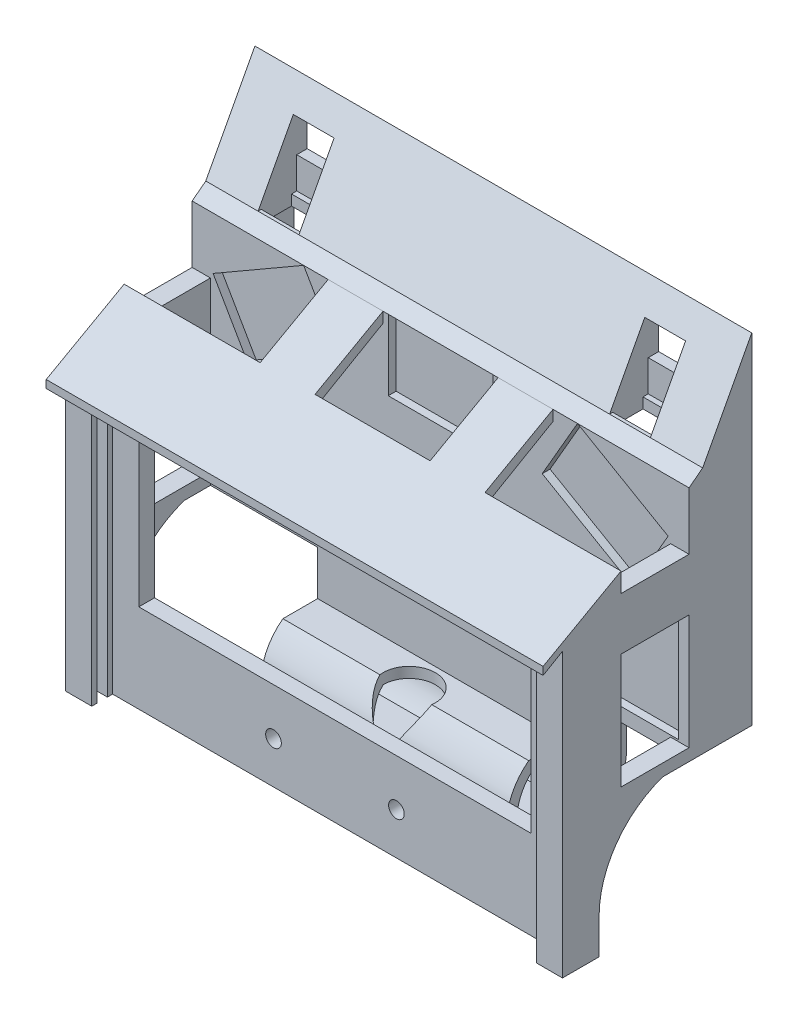
from build123d import *

# Parameters (mm, degrees)
SALIENTE_EXTRUIR1_DEPTH    = 12
CORTAR_EXTRUIR1_DEPTH      = 107.888961076
SALIENTE_EXTRUIR2_DEPTH    = 95
CORTAR_EXTRUIR2_DEPTH      = 44
CORTAR_EXTRUIR2_DEPTH_BACK = 44
CROQUIS6_W                 = 75
CROQUIS6_H                 = 35
CORTAR_EXTRUIR3_DEPTH      = 5
CROQUIS8_W                 = 13
CROQUIS8_H                 = 22
CORTAR_EXTRUIR10_DEPTH     = 114.460389564
CROQUIS9_W                 = 22
CROQUIS9_H                 = 13
CORTAR_EXTRUIR11_DEPTH     = 114.460389564
CROQUIS10_W                = 13
CROQUIS10_H                = 13
CORTAR_EXTRUIR12_DEPTH     = 26
CROQUIS11_W                = 13
CROQUIS11_H                = 13
CORTAR_EXTRUIR13_DEPTH     = 26
CROQUIS12_W                = 80
CROQUIS12_H                = 40
CORTAR_EXTRUIR15_DEPTH     = 6.3
SALIENTE_EXTRUIR3_START    = -47
SALIENTE_EXTRUIR3_DEPTH    = 47
CORTAR_EXTRUIR21_DEPTH     = 47
CROQUIS7_W                 = 20
CROQUIS7_H                 = 13.5
CROQUIS7_W_2               = 13.5
CROQUIS7_H_2               = 20
CORTAR_EXTRUIR22_DEPTH     = 1.5
CROQUIS16_R                = 5
CORTAR_EXTRUIR17_DEPTH     = 10
CROQUIS19_R                = 1.5
CORTAR_EXTRUIR18_DEPTH     = 10
CROQUIS21_W                = 7.8
CROQUIS21_H                = 13
CORTAR_EXTRUIR19_DEPTH     = 10
CORTAR_EXTRUIR20_START     = -47.5
CORTAR_EXTRUIR20_DEPTH     = 95
CROQUIS23_W                = 7.8
CROQUIS23_H                = 6
SALIENTE_EXTRUIR4_DEPTH    = 2
CROQUIS24_W                = 7.8
CROQUIS24_H                = 7
CORTAR_EXTRUIR23_DEPTH     = 40
CROQUIS25_W                = 10
CROQUIS25_H                = 10
CORTAR_EXTRUIR24_DEPTH     = 2
CROQUIS26_W                = 10
CROQUIS26_H                = 10
CORTAR_EXTRUIR27_DEPTH     = 10
SALIENTE_EXTRUIR5_DEPTH    = 47.5
CORTAR_EXTRUIR28_DEPTH     = 47.5
CROQUIS32_W                = 5
CROQUIS32_H                = 6.72
CROQUIS32_H_2              = 6.717154673
SALIENTE_EXTRUIR10_DEPTH   = 8
SALIENTE_EXTRUIR11_START   = -5
SALIENTE_EXTRUIR11_DEPTH   = 5
SALIENTE_EXTRUIR12_DEPTH   = 5
SALIENTE_EXTRUIR13_DEPTH   = 5
SALIENTE_EXTRUIR14_REACH   = 110.254


with BuildPart() as part:
    # Croquis2 → Saliente-Extruir1 (new body)
    with BuildSketch(Plane.XY):
        Polygon((-47.5, -17.5), (-23.5, -17.5), (-23.5, -47.5), (23.5, -47.5), (23.5, -17.5), (47.5, -17.5), (47.5, 47.5), (-47.5, 47.5), align=None)
    extrude(amount=SALIENTE_EXTRUIR1_DEPTH)

    # Croquis3 → Cortar-Extruir1 (cut, through all)
    with BuildSketch(Plane.ZY.offset(47.5)):
        Polygon((0, 47.5), (9.389431256, 29.841048143), (12, 29.841048143), (12, 47.5), align=None)
    extrude(amount=-CORTAR_EXTRUIR1_DEPTH, mode=Mode.SUBTRACT)

    # Croquis4 → Saliente-Extruir2 (add, through all)
    with BuildSketch(Plane.ZY.offset(47.5)):
        with BuildLine():
            Line((39.9, 13.732975632), (39.9, 10.732975632))
            Line((39.9, 10.732975632), (32.196099855, 15.180824455))
            Line((32.196099855, 15.180824455), (32.196099855, -33.217154673))
            Line((32.196099855, -33.217154673), (32.196099855, -41.217154673))
            Line((32.196099855, -41.217154673), (29.196099855, -41.217154673))
            Line((29.196099855, -41.217154673), (29.196099855, -34.5))
            ThreePointArc((29.196099855, -34.5), (25.831710705, -24.03882354), (17, -17.5))
            Line((17, -17.5), (12, -17.5))
            Line((12, -17.5), (12, 29.841048143))
            Line((12, 29.841048143), (39.9, 13.732975632))
        make_face()
    extrude(amount=-SALIENTE_EXTRUIR2_DEPTH)

    # Croquis5 → Cortar-Extruir2 (cut, two sides: drawn at the far end of the back side and taken through both)
    with BuildSketch(Plane.ZY.offset(-CORTAR_EXTRUIR2_DEPTH_BACK)):
        Polygon((12, 25.841048143), (29.196099855, 15.912875263), (29.196099855, -32.087124737), (12, -32.087124737), (12, -17.5), align=None)
    extrude(amount=CORTAR_EXTRUIR2_DEPTH + CORTAR_EXTRUIR2_DEPTH_BACK, mode=Mode.SUBTRACT)

    # Croquis6 → Cortar-Extruir3 (cut)
    with BuildSketch(Plane.XY.offset(32.196099855)):
        with Locations((0, -6.767024368)):
            Rectangle(CROQUIS6_W, CROQUIS6_H)
    extrude(amount=-CORTAR_EXTRUIR3_DEPTH, mode=Mode.SUBTRACT)

    # Croquis8 → Cortar-Extruir10 (cut, through all)
    with BuildSketch(Plane(origin=(47.5, 0, 0), x_dir=(0, 0, -1), z_dir=(1, 0, 0))):
        with Locations((-18.5, -4.19274225)):
            Rectangle(CROQUIS8_W, CROQUIS8_H)
    extrude(amount=-CORTAR_EXTRUIR10_DEPTH, mode=Mode.SUBTRACT)

    # Croquis9 → Cortar-Extruir11 (cut, through all)
    with BuildSketch(Plane.XZ.offset(47.5)):
        with Locations((0, 18.5)):
            Rectangle(CROQUIS9_W, CROQUIS9_H)
    extrude(amount=-CORTAR_EXTRUIR11_DEPTH, mode=Mode.SUBTRACT)

    # Croquis10 → Cortar-Extruir12 (cut)
    with BuildSketch(Plane.ZY.offset(47.5)):
        with Locations((18.5, 23.341048143)):
            Rectangle(CROQUIS10_W, CROQUIS10_H)
    extrude(amount=-CORTAR_EXTRUIR12_DEPTH, mode=Mode.SUBTRACT)

    # Croquis11 → Cortar-Extruir13 (cut)
    with BuildSketch(Plane(origin=(47.5, 0, 0), x_dir=(0, 0, -1), z_dir=(1, 0, 0))):
        with Locations((-18.5, 23.341048143)):
            Rectangle(CROQUIS11_W, CROQUIS11_H)
    extrude(amount=-CORTAR_EXTRUIR13_DEPTH, mode=Mode.SUBTRACT)

    # Croquis12 → Cortar-Extruir15 (cut)
    with BuildSketch(Plane(origin=(0, 0, 0), x_dir=(-1, 0, 0), z_dir=(0, 0, -1))):
        with Locations((0, 7.5)):
            Rectangle(CROQUIS12_W, CROQUIS12_H)
    extrude(amount=-CORTAR_EXTRUIR15_DEPTH, mode=Mode.SUBTRACT)

    # Croquis14 → Saliente-Extruir3 (add)
    with BuildSketch(Plane.ZY.offset(23.5).offset(SALIENTE_EXTRUIR3_START)):
        with BuildLine():
            Line((17.941169502, -41), (12, -41))
            Line((12, -41), (12, -43))
            Line((12, -43), (18.648988318, -43))
            ThreePointArc((18.648988318, -43), (22.889410298, -34.5), (18.648988318, -26))
            Line((18.648988318, -26), (12, -26))
            Line((12, -26), (12, -28))
            Line((12, -28), (17.941169502, -28))
            ThreePointArc((17.941169502, -28), (20.889410298, -34.5), (17.941169502, -41))
        make_face()
    extrude(amount=SALIENTE_EXTRUIR3_DEPTH)

    # Croquis15 → Cortar-Extruir21 (cut)
    with BuildSketch(Plane.ZY.offset(23.5)):
        with BuildLine():
            Line((12, -28), (6.965348316, -28))
            ThreePointArc((6.965348316, -28), (4.272960161, -34.5), (6.965348316, -41))
            Line((6.965348316, -41), (12, -41))
            Line((12, -41), (12, -28))
        make_face()
        with BuildLine():
            Line((12, -43), (12, -47.5))
            Line((12, -47.5), (0, -47.5))
            Line((0, -47.5), (0, -34.5))
            add(Edge.make_bspline(
                [(5.965348316, -43), (0.686853586, -40.707296521), (0, -34.5)],
                knots=[0, 0, 0, 1, 1, 1], degree=2))
            Line((5.965348316, -43), (12, -43))
        make_face()
    extrude(amount=-CORTAR_EXTRUIR21_DEPTH, mode=Mode.SUBTRACT)

    # Croquis7 → Cortar-Extruir22 (cut)
    with BuildSketch(Plane.XY.offset(12)):
        with Locations((0, 21.091048143)):
            Rectangle(CROQUIS7_W, CROQUIS7_H)
        Polygon((26.179491924, 27.841048143), (43.5, 17.841048143), (36.75, 6.149705192), (19.429491924, 16.149705192), align=None)
        Polygon((-26.179491924, 27.841048143), (-43.5, 17.841048143), (-36.75, 6.149705192), (-19.429491924, 16.149705192), align=None)
        with Locations((-38.75, -4.850294808)):
            Rectangle(CROQUIS7_W_2, CROQUIS7_H_2)
        with Locations((38.75, -4.850294808)):
            Rectangle(CROQUIS7_W_2, CROQUIS7_H_2)
    extrude(amount=-CORTAR_EXTRUIR22_DEPTH, mode=Mode.SUBTRACT)

    # Croquis16 → Cortar-Extruir17 (cut)
    with BuildSketch(Plane(origin=(0, -26, 0), x_dir=(1, 0, 0), z_dir=(0, 1, 0))):
        with Locations((0, -18)):
            Circle(CROQUIS16_R)
    extrude(amount=-CORTAR_EXTRUIR17_DEPTH, mode=Mode.SUBTRACT)

    # Croquis19 → Cortar-Extruir18 (cut)
    with BuildSketch(Plane.XY.offset(32.196099855)):
        with Locations((-11.75, -33.217154673)):
            Circle(CROQUIS19_R)
        with Locations((11.75, -33.217154673)):
            Circle(CROQUIS19_R)
    extrude(amount=-CORTAR_EXTRUIR18_DEPTH, mode=Mode.SUBTRACT)

    # Croquis21 → Cortar-Extruir19 (cut)
    with BuildSketch(Plane(origin=(0, 0, 0), x_dir=(-1, 0, 0), z_dir=(0, 0, -1))):
        with Locations((-33.6, 36)):
            Rectangle(CROQUIS21_W, CROQUIS21_H)
        with Locations((33.6, 36)):
            Rectangle(CROQUIS21_W, CROQUIS21_H)
    extrude(amount=-CORTAR_EXTRUIR19_DEPTH, mode=Mode.SUBTRACT)

    # Croquis22 → Cortar-Extruir20 (cut)
    with BuildSketch(Plane.ZY.offset(CORTAR_EXTRUIR20_START)):
        Polygon((39.9, 13.732975632), (39.9, 12.232975632), (12, 27.841048143), (12, 28.341048143), (9, 28.341048143), (9, 29.341048143), (12, 29.341048143), (12, 29.841048143), align=None)
    extrude(amount=CORTAR_EXTRUIR20_DEPTH, mode=Mode.SUBTRACT)

    # Croquis23 → Saliente-Extruir4 (add)
    with BuildSketch(Plane(origin=(0, 0, 0), x_dir=(-1, 0, 0), z_dir=(0, 0, -1))):
        with Locations((33.6, 32.5)):
            Rectangle(CROQUIS23_W, CROQUIS23_H)
        with Locations((-33.6, 32.5)):
            Rectangle(CROQUIS23_W, CROQUIS23_H)
    extrude(amount=-SALIENTE_EXTRUIR4_DEPTH)

    # Croquis24 → Cortar-Extruir23 (cut)
    with BuildSketch(Plane(origin=(0, 29.5, 0), x_dir=(1, 0, 0), z_dir=(0, 1, 0))):
        with Locations((33.6, -6.5)):
            Rectangle(CROQUIS24_W, CROQUIS24_H)
        with Locations((-33.6, -6.5)):
            Rectangle(CROQUIS24_W, CROQUIS24_H)
    extrude(amount=-CORTAR_EXTRUIR23_DEPTH, mode=Mode.SUBTRACT)

    # Croquis25 → Cortar-Extruir24 (cut)
    with BuildSketch(Plane(origin=(0, 0, 6.3), x_dir=(-1, 0, 0), z_dir=(0, 0, -1))):
        with Locations((-24.7, -5.5)):
            Rectangle(CROQUIS25_W, CROQUIS25_H)
        with Locations((24.7, -5.5)):
            Rectangle(CROQUIS25_W, CROQUIS25_H)
    extrude(amount=-CORTAR_EXTRUIR24_DEPTH, mode=Mode.SUBTRACT)

    # Croquis26 → Cortar-Extruir27 (cut)
    with BuildSketch(Plane(origin=(0, 0, 6.3), x_dir=(-1, 0, 0), z_dir=(0, 0, -1))):
        with Locations((-24.7, -5.5)):
            Rectangle(CROQUIS26_W, CROQUIS26_H)
        with Locations((24.7, -5.5)):
            Rectangle(CROQUIS26_W, CROQUIS26_H)
    extrude(amount=-CORTAR_EXTRUIR27_DEPTH, mode=Mode.SUBTRACT)

    # Croquis28 → Saliente-Extruir5 (add, symmetric)
    with BuildSketch(Plane(origin=(0, 0, 0), x_dir=(0, 0, -1), z_dir=(1, 0, 0))):
        Polygon((-12, 27.841048143), (-9.389431256, 29.841048143), (-8.784174697, 29.841048143), (-8.784174697, 27.841048143), align=None)
    extrude(amount=SALIENTE_EXTRUIR5_DEPTH, both=True)

    # Croquis29 → Cortar-Extruir28 (cut, symmetric)
    with BuildSketch(Plane(origin=(0, 0, 0), x_dir=(0, 0, -1), z_dir=(1, 0, 0))):
        Polygon((-12, 29.841048143), (-10, 29.841048143), (-9.389431256, 29.841048143), (-10.042073442, 29.341048143), (-11.347357814, 28.341048143), (-12, 27.841048143), align=None)
    extrude(amount=CORTAR_EXTRUIR28_DEPTH, both=True, mode=Mode.SUBTRACT)

    # Croquis32 → Saliente-Extruir10 (add)
    with BuildSketch(Plane(origin=(0, 0, 29.196099855), x_dir=(-1, 0, 0), z_dir=(0, 0, -1))):
        with Locations((-17.151855305, -37.86)):
            Rectangle(CROQUIS32_W, CROQUIS32_H)
        with Locations((-0.922613895, -37.858577337)):
            Rectangle(CROQUIS32_W, CROQUIS32_H_2)
        with Locations((17.344282018, -37.858577337)):
            Rectangle(CROQUIS32_W, CROQUIS32_H_2)
    extrude(amount=SALIENTE_EXTRUIR10_DEPTH)

    # Croquis34 → Saliente-Extruir11 (add)
    with BuildSketch(Plane.ZY.offset(19.844282018).offset(SALIENTE_EXTRUIR11_START)):
        with BuildLine():
            Line((21.196099855, -41.217154673), (20.044572969, -41.74166305))
            Line((20.044572969, -41.74166305), (21.196099855, -40.258849614))
            ThreePointArc((21.196099855, -40.258849614), (22.457308127, -37.501318424), (22.889410298, -34.5))
            Line((22.889410298, -34.5), (29.196099855, -34.5))
            Line((29.196099855, -34.5), (29.196099855, -41.217154673))
            Line((29.196099855, -41.217154673), (21.196099855, -41.217154673))
        make_face()
    extrude(amount=SALIENTE_EXTRUIR11_DEPTH)

    # Croquis35 → Saliente-Extruir12 (add)
    with BuildSketch(Plane.ZY.offset(1.577386105)):
        Polygon((21.196099855, -41.217154673), (20.044572969, -41.74166305), (21.196099855, -40.258849614), align=None)
    extrude(amount=-SALIENTE_EXTRUIR12_DEPTH)

    # Croquis37 → Saliente-Extruir13 (add)
    with BuildSketch(Plane(origin=(19.651855305, 0, 0), x_dir=(0, 0, -1), z_dir=(1, 0, 0))):
        Polygon((-21.196099855, -41.22), (-20.044572969, -41.74166305), (-21.204387645, -40.245954524), align=None)
    extrude(amount=-SALIENTE_EXTRUIR13_DEPTH)

    # Saliente-Extruir14: up to this plane
    saliente_extruir14_end = Plane(origin=(47.5, 10.732975632, 39.9), z_dir=(0, -0.8660254037844399, -0.4999999999999977))
    # Croquis38 → Saliente-Extruir14 (add, up to the surface)
    with BuildSketch(Plane.XZ.offset(41.217154673), mode=Mode.PRIVATE) as saliente_extruir14_sk1:
        Polygon((-47.5, 32.196099855), (-47.5, 36.196099855), (-42.5, 36.196099855), (-42.5, 35.196099855), (-46, 35.196099855), (-46, 33.196099855), (-42.5, 33.196099855), (-42.5, 32.196099855), align=None)
    saliente_extruir14_tool1 = split(extrude(saliente_extruir14_sk1.sketch, amount=-SALIENTE_EXTRUIR14_REACH, mode=Mode.PRIVATE), bisect_by=saliente_extruir14_end, keep=Keep.BOTH, mode=Mode.PRIVATE)
    saliente_extruir14 = saliente_extruir14_tool1.solids().sort_by_distance((-47.435969, -41.217155, 34.1961))[0]
    add(saliente_extruir14)

    # Simetría1: Saliente-Extruir14 across plane
    add(saliente_extruir14.mirror(Plane(origin=(0, 0, 0), x_dir=(0, 0, 1), z_dir=(1, 0, 0))))


solid = part.part
